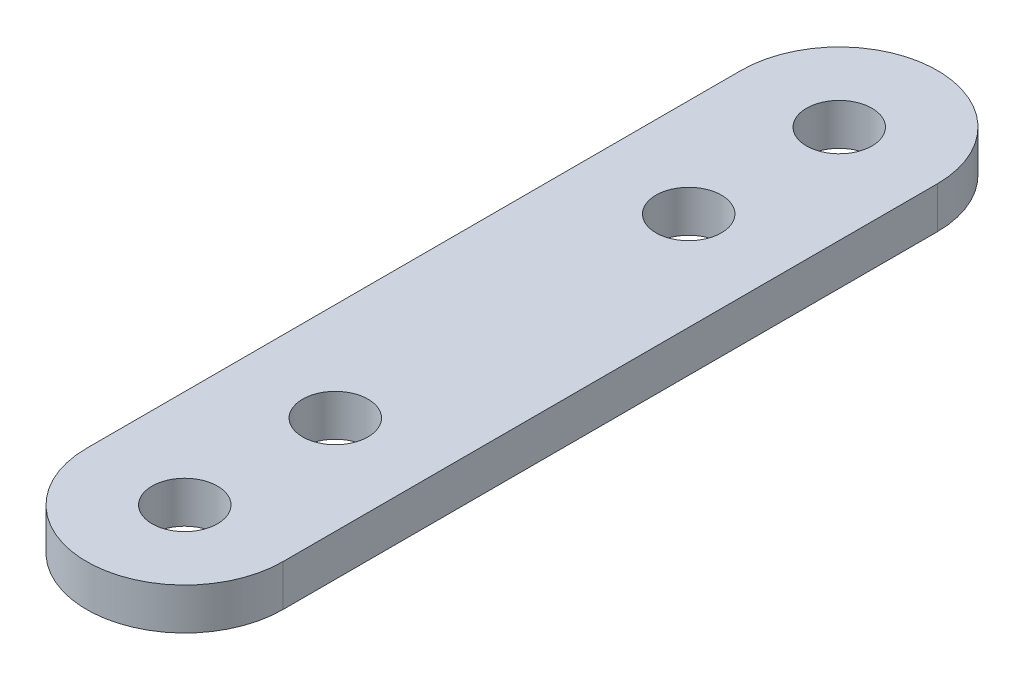
from build123d import *

# Parameters (mm, degrees)
SKETCH1_R           = 2.5
BOSS_EXTRUDE1_DEPTH = 3.175


with BuildPart() as part:
    # Sketch1 → Boss-Extrude1 (new body)
    with BuildSketch(Plane(origin=(0, 0, 0), x_dir=(1, 0, 0), z_dir=(0, 1, 0))):
        with BuildLine():
            Line((-7.5, 25), (-7.5, -25))
            ThreePointArc((-7.5, -25), (0, -32.5), (7.5, -25))
            Line((7.5, -25), (7.5, 25))
            ThreePointArc((7.5, 25), (0, 32.5), (-7.5, 25))
        make_face()
        with Locations(Location((0, 25, 0), (0, 0, 270))):
            Circle(SKETCH1_R, mode=Mode.SUBTRACT)
        with Locations(Location((0, -25, 0), (0, 0, 270))):
            Circle(SKETCH1_R, mode=Mode.SUBTRACT)
        with Locations(Location((0, 13.5, 0), (0, 0, 270))):
            Circle(SKETCH1_R, mode=Mode.SUBTRACT)
        with Locations(Location((0, -13.5, 0), (0, 0, 270))):
            Circle(SKETCH1_R, mode=Mode.SUBTRACT)
    extrude(amount=BOSS_EXTRUDE1_DEPTH)


solid = part.part
